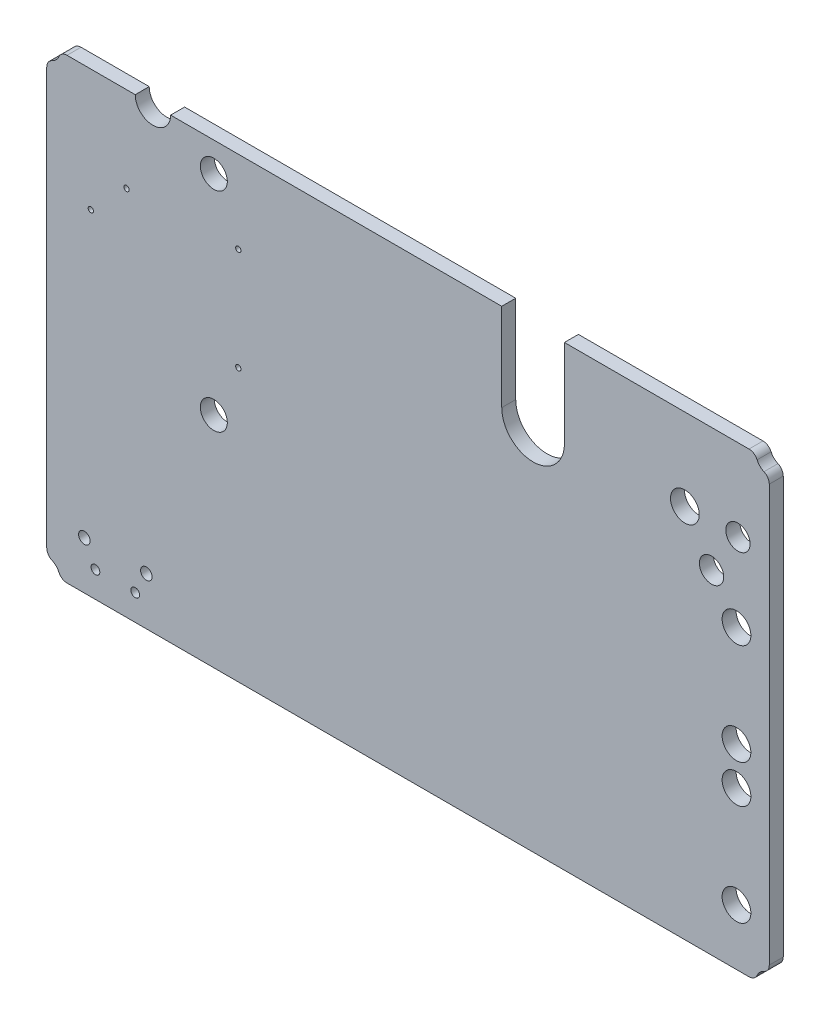
from build123d import *

# Parameters (mm, degrees)
BOSS_EXTRUDE2_DEPTH = 1.58
CUT_EXTRUDE4_DEPTH  = 49.333297529
SKETCH6_R           = 0.3
CUT_EXTRUDE9_DEPTH  = 49.333297529
SKETCH5_R           = 0.3
SKETCH5_R_2         = 1.525
CUT_EXTRUDE10_DEPTH = 49.333297529
SKETCH7_R           = 0.65
SKETCH7_R_2         = 0.495
SKETCH7_R_3         = 0.3
SKETCH7_R_4         = 1.625
SKETCH7_R_5         = 1.375
CUT_EXTRUDE11_DEPTH = 49.333297529
SKETCH13_R          = 2
CUT_EXTRUDE12_DEPTH = 49.333297529


with BuildPart() as part:
    # Sketch3 → Boss-Extrude2 (new body)
    with BuildSketch(Plane.XY):
        with BuildLine():
            Line((-38.533712153, -25.825), (38.533712153, -25.825))
            ThreePointArc((38.533712153, -25.825), (39.08143471, -25.661660027), (39.450227292, -25.225))
            ThreePointArc((39.450227292, -25.225), (39.764339828, -24.764339828), (40.225, -24.450227292))
            ThreePointArc((40.225, -24.450227292), (40.661660027, -24.08143471), (40.825, -23.533712153))
            Line((40.825, -23.533712153), (40.825, 23.533712153))
            ThreePointArc((40.825, 23.533712153), (40.661660027, 24.08143471), (40.225, 24.450227292))
            ThreePointArc((40.225, 24.450227292), (39.764339828, 24.764339828), (39.450227292, 25.225))
            ThreePointArc((39.450227292, 25.225), (39.08143471, 25.661660027), (38.533712153, 25.825))
            Line((38.533712153, 25.825), (-38.533712153, 25.825))
            ThreePointArc((-38.533712153, 25.825), (-39.08143471, 25.661660027), (-39.450227292, 25.225))
            ThreePointArc((-39.450227292, 25.225), (-39.764339828, 24.764339828), (-40.225, 24.450227292))
            ThreePointArc((-40.225, 24.450227292), (-40.661660027, 24.08143471), (-40.825, 23.533712153))
            Line((-40.825, 23.533712153), (-40.825, -23.533712153))
            ThreePointArc((-40.825, -23.533712153), (-40.661660027, -24.08143471), (-40.225, -24.450227292))
            ThreePointArc((-40.225, -24.450227292), (-39.764339828, -24.764339828), (-39.450227292, -25.225))
            ThreePointArc((-39.450227292, -25.225), (-39.08143471, -25.661660027), (-38.533712153, -25.825))
        make_face()
    extrude(amount=BOSS_EXTRUDE2_DEPTH)

    # Sketch8 → Cut-Extrude4 (cut, through all)
    with BuildSketch(Plane.XY.offset(1.58)):
        with BuildLine():
            Line((10.592557127, 25.825), (10.592557127, 15.905077804))
            ThreePointArc((10.592557127, 15.905077804), (14.134043321, 12.36359161), (17.675529515, 15.905077804))
            Line((17.675529515, 15.905077804), (17.675529515, 25.825))
            Line((17.675529515, 25.825), (10.592557127, 25.825))
        make_face()
    extrude(amount=-CUT_EXTRUDE4_DEPTH, mode=Mode.SUBTRACT)

    # Sketch6 → Cut-Extrude9 (cut, through all)
    with BuildSketch(Plane.XY.offset(1.58)):
        with Locations((-19.175, 16.525)):
            Circle(SKETCH6_R)
        with Locations((-19.175, 4.925)):
            Circle(SKETCH6_R)
    extrude(amount=-CUT_EXTRUDE9_DEPTH, mode=Mode.SUBTRACT)

    # Sketch5 → Cut-Extrude10 (cut, through all)
    with BuildSketch(Plane(origin=(0, 0, 0), x_dir=(1, 0, 0), z_dir=(0, 0, -1))):
        with Locations((-19.175, -4.925)):
            Circle(SKETCH5_R)
        with Locations((-19.175, -16.525)):
            Circle(SKETCH5_R)
        with Locations(Location((-21.945, -22.525, 0), (0, 0, 180))):
            Circle(SKETCH5_R_2)
        with Locations(Location((-21.945, 1.075, 0), (0, 0, 180))):
            Circle(SKETCH5_R_2)
    extrude(amount=-CUT_EXTRUDE10_DEPTH, mode=Mode.SUBTRACT)

    # Sketch7 → Cut-Extrude11 (cut, through all)
    with BuildSketch(Plane(origin=(0, 0, 0), x_dir=(1, 0, 0), z_dir=(0, 0, -1))):
        with Locations(Location((-36.578389688, 20.415177754, 0), (0, 0, 270))):
            Circle(SKETCH7_R)
        with Locations(Location((-29.568389688, 20.415177754, 0), (0, 0, 270))):
            Circle(SKETCH7_R)
        with Locations(Location((-35.323389688, 22.905177754, 0), (0, 0, 270))):
            Circle(SKETCH7_R_2)
        with Locations(Location((-30.823389688, 22.905177754, 0), (0, 0, 270))):
            Circle(SKETCH7_R_2)
        with Locations(Location((-35.839874228, -12.060017363, 0), (0, 0, 270))):
            Circle(SKETCH7_R_3)
        with Locations(Location((-31.810125772, -16.157982637, 0), (0, 0, 270))):
            Circle(SKETCH7_R_3)
        with Locations(Location((31.286432501, -16.58, 0), (0, 0, 270))):
            Circle(SKETCH7_R_4)
        with Locations(Location((37.283538512, -16.58, 0), (0, 0, 270))):
            Circle(SKETCH7_R_5)
        with Locations(Location((34.3, -11.85761971, 0), (0, 0, 270))):
            Circle(SKETCH7_R_5)
        with Locations(Location((37.12, -7.675, 0), (0, 0, 270))):
            Circle(SKETCH7_R_4)
        with Locations(Location((37.12, 3.755, 0), (0, 0, 270))):
            Circle(SKETCH7_R_4)
        with Locations(Location((37.12, 8.065, 0), (0, 0, 270))):
            Circle(SKETCH7_R_4)
        with Locations(Location((37.12, 19.495, 0), (0, 0, 270))):
            Circle(SKETCH7_R_4)
    extrude(amount=-CUT_EXTRUDE11_DEPTH, mode=Mode.SUBTRACT)

    # Sketch13 → Cut-Extrude12 (cut, through all)
    with BuildSketch(Plane.XY.offset(1.58)):
        with Locations((-28.825, 25.825)):
            Circle(SKETCH13_R)
    extrude(amount=-CUT_EXTRUDE12_DEPTH, mode=Mode.SUBTRACT)


solid = part.part
